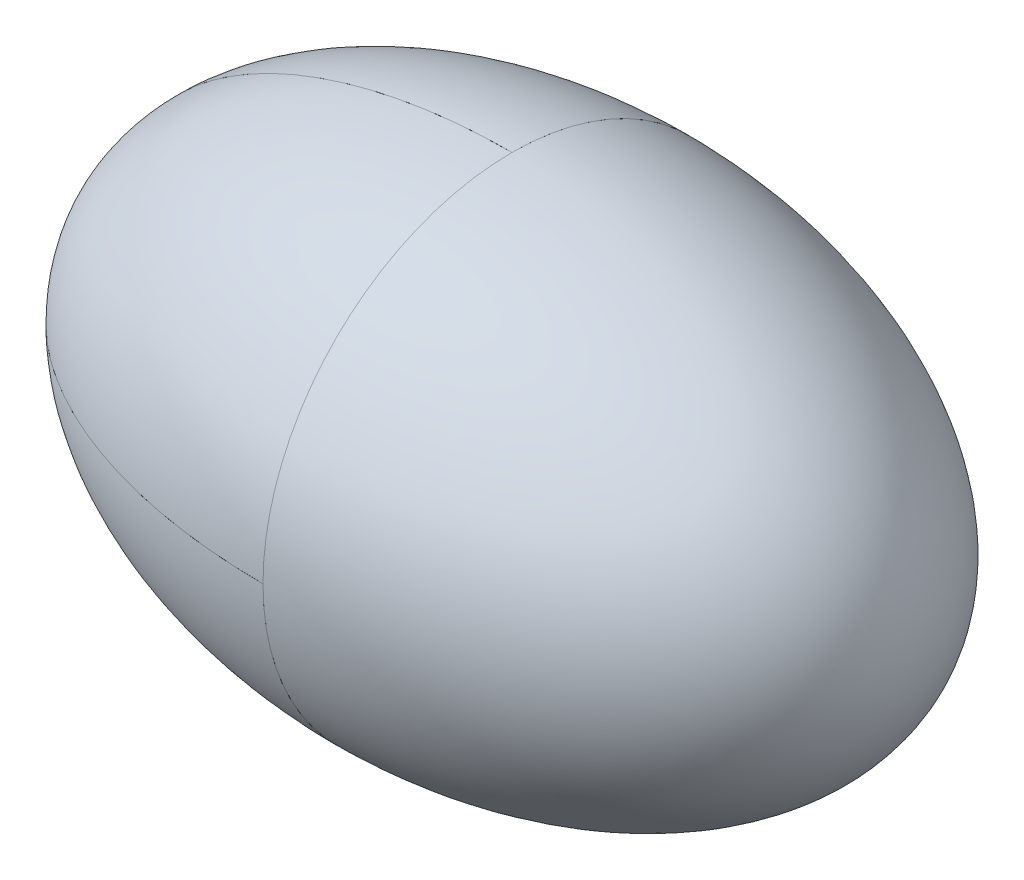
from build123d import *

# Parameters (mm, degrees)
REVOLVE2_ANGLE = 90
REVOLVE3_ANGLE = 90
REVOLVE5_ANGLE = 90
REVOLVE6_ANGLE = 90


with BuildPart() as part:
    # Sketch1 → Revolve2 (revolve)
    with BuildSketch(Plane.XY):
        with BuildLine():
            Line((-134.62, 0), (0, 0))
            Line((0, 0), (0, 85.09))
            add(Edge.make_bspline(
                [(0, 85.09), (-134.62, 85.09), (-134.62, 0)],
                knots=[1.570796327, 1.570796327, 1.570796327, 3.141592654, 3.141592654, 3.141592654], degree=2, weights=[1, 0.707106781, 1]))
        make_face()
    revolve(axis=Axis((-134.62, 0, 0), (1, 0, 0)), revolution_arc=REVOLVE2_ANGLE)


with BuildPart() as body_2:
    # Sketch3 → Revolve3 (revolve)
    with BuildSketch(Plane.XY):
        with BuildLine():
            Line((-134.62, 0), (0, 0))
            Line((0, 0), (0, -85.09))
            add(Edge.make_bspline(
                [(-134.62, 0), (-134.62, -85.09), (0, -85.09)],
                knots=[3.141592654, 3.141592654, 3.141592654, 4.71238898, 4.71238898, 4.71238898], degree=2, weights=[1, 0.707106781, 1]))
        make_face()
    revolve(axis=Axis((-134.62, 0, 0), (1, 0, 0)), revolution_arc=REVOLVE3_ANGLE)


with BuildPart() as body_3:
    # Sketch4 → Revolve5 (revolve)
    with BuildSketch(Plane(origin=(0, 0, 0), x_dir=(-1, 0, 0), z_dir=(0, 0, -1))):
        with BuildLine():
            Line((0, 0), (134.62, 0))
            add(Edge.make_bspline(
                [(134.62, 0), (134.62, 85.09), (0, 85.09)],
                knots=[0, 0, 0, 1.570796327, 1.570796327, 1.570796327], degree=2, weights=[1, 0.707106781, 1]))
            Line((0, 85.09), (0, 0))
        make_face()
    revolve(axis=Axis((0, 0, 0), (-1, 0, 0)), revolution_arc=REVOLVE5_ANGLE)


with BuildPart() as body_4:
    # Sketch5 → Revolve6 (revolve)
    with BuildSketch(Plane.XY):
        with BuildLine():
            Line((-134.62, 0), (0, 0))
            Line((0, 0), (0, -85.09))
            add(Edge.make_bspline(
                [(-134.62, 0), (-134.62, -85.09), (0, -85.09)],
                knots=[0, 0, 0, 1.570796327, 1.570796327, 1.570796327], degree=2, weights=[1, 0.707106781, 1]))
        make_face()
    revolve(axis=Axis((-134.62, 0, 0), (-1, 0, 0)), revolution_arc=REVOLVE6_ANGLE)


with BuildPart() as body_5:
    # Sketch6 → Revolve8 (revolve)
    with BuildSketch(Plane.XY):
        with BuildLine():
            Line((0, 0), (134.62, 0))
            add(Edge.make_bspline(
                [(134.62, 0), (134.62, 85.09), (0, 85.09)],
                knots=[3.141592654, 3.141592654, 3.141592654, 4.71238898, 4.71238898, 4.71238898], degree=2, weights=[1, 0.707106781, 1]))
            Line((0, 85.09), (0, 0))
        make_face()
    revolve(axis=Axis((0, 0, 0), (1, 0, 0)))


solid = Compound([part.part, body_2.part, body_3.part, body_4.part, body_5.part])
